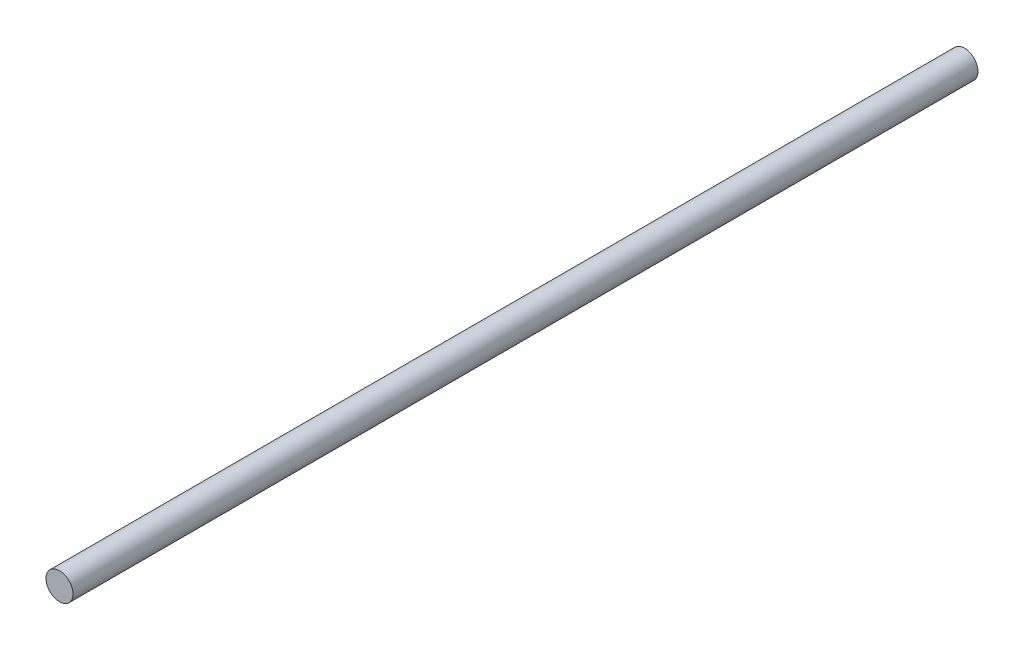
from build123d import *

# Parameters (mm, degrees)
ESQUISSE1_R        = 5
BOSS_EXTRU_1_DEPTH = 335


with BuildPart() as part:
    # Esquisse1 → Boss.-Extru.1 (new body)
    with BuildSketch(Plane.XY):
        Circle(ESQUISSE1_R)
    extrude(amount=BOSS_EXTRU_1_DEPTH)


solid = part.part
